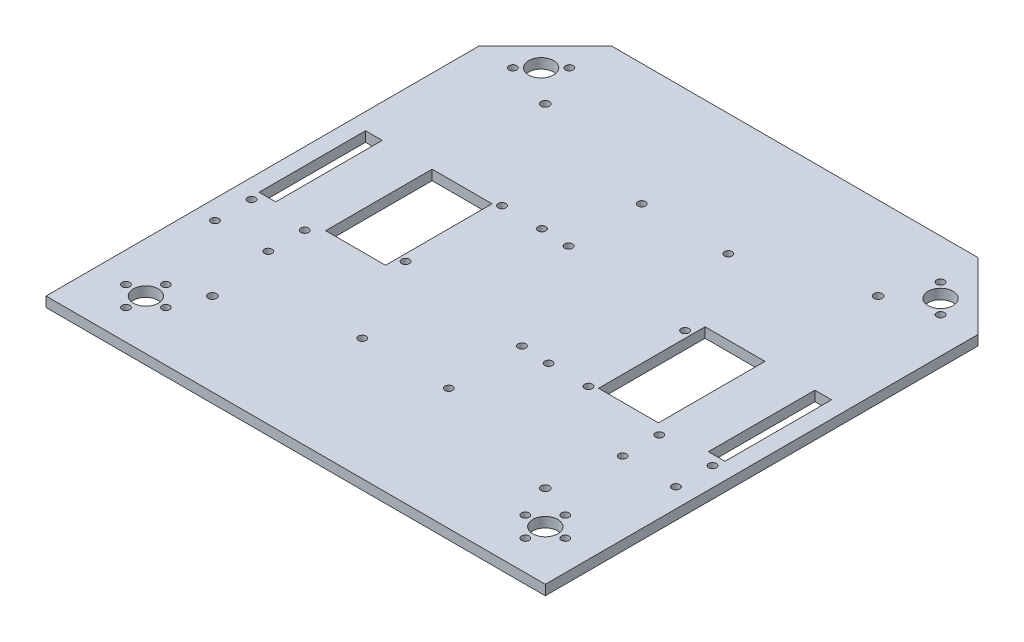
from build123d import *

# Parameters (mm, degrees)
ESQUISSE1_R              = 7.5
ESQUISSE1_R_2            = 2.3
BOSS_EXTRU_1_DEPTH       = 6
ENL_V_MAT_EXTRU_9_DEPTH  = 10.5
ESQUISSE6_R              = 2.3
ENL_V_MAT_EXTRU_10_DEPTH = 50
ENL_V_MAT_EXTRU_11_DEPTH = 50
ESQUISSE9_R              = 2.5
ENL_V_MAT_EXTRU_12_DEPTH = 35
ESQUISSE11_R             = 2.3
ENL_V_MAT_EXTRU_15_DEPTH = 10


with BuildPart() as part:
    # Esquisse1 → Boss.-Extru.1 (new body)
    with BuildSketch(Plane(origin=(0, 0, 0), x_dir=(1, 0, 0), z_dir=(0, 1, 0))):
        Polygon((-150, 0), (-150, 260), (-110, 300), (110, 300), (150, 260), (150, 0), align=None)
        with Locations(Location((-120, 30, 0), (0, 0, 270))):
            Circle(ESQUISSE1_R, mode=Mode.SUBTRACT)
        with Locations(Location((-120, 267.5, 0), (0, 0, 270))):
            Circle(ESQUISSE1_R, mode=Mode.SUBTRACT)
        with Locations(Location((120, 267.5, 0), (0, 0, 270))):
            Circle(ESQUISSE1_R, mode=Mode.SUBTRACT)
        with Locations(Location((-111.514718626, 275.985281374, 0), (0, 0, 270))):
            Circle(ESQUISSE1_R_2, mode=Mode.SUBTRACT)
        with Locations(Location((-128.485281374, 259.014718626, 0), (0, 0, 270))):
            Circle(ESQUISSE1_R_2, mode=Mode.SUBTRACT)
        with Locations(Location((111.514718626, 275.985281374, 0), (0, 0, 270))):
            Circle(ESQUISSE1_R_2, mode=Mode.SUBTRACT)
        with Locations(Location((128.485281374, 259.014718626, 0), (0, 0, 270))):
            Circle(ESQUISSE1_R_2, mode=Mode.SUBTRACT)
        with Locations(Location((120, 30, 0), (0, 0, 270))):
            Circle(ESQUISSE1_R, mode=Mode.SUBTRACT)
        with Locations(Location((120, 42, 0), (0, 0, 270))):
            Circle(ESQUISSE1_R_2, mode=Mode.SUBTRACT)
        with Locations(Location((-120, 42, 0), (0, 0, 270))):
            Circle(ESQUISSE1_R_2, mode=Mode.SUBTRACT)
        with Locations(Location((-120, 18, 0), (0, 0, 270))):
            Circle(ESQUISSE1_R_2, mode=Mode.SUBTRACT)
        with Locations(Location((-132, 30, 0), (0, 0, 270))):
            Circle(ESQUISSE1_R_2, mode=Mode.SUBTRACT)
        with Locations(Location((-108, 30, 0), (0, 0, 270))):
            Circle(ESQUISSE1_R_2, mode=Mode.SUBTRACT)
        with Locations(Location((108, 30, 0), (0, 0, 270))):
            Circle(ESQUISSE1_R_2, mode=Mode.SUBTRACT)
        with Locations(Location((132, 30, 0), (0, 0, 270))):
            Circle(ESQUISSE1_R_2, mode=Mode.SUBTRACT)
        with Locations(Location((120, 18, 0), (0, 0, 270))):
            Circle(ESQUISSE1_R_2, mode=Mode.SUBTRACT)
    extrude(amount=BOSS_EXTRU_1_DEPTH)

    # Esquisse7 → Enlèv. mat.-Extru.9 (cut)
    with BuildSketch(Plane(origin=(0, 6, 0), x_dir=(1, 0, 0), z_dir=(0, 1, 0))):
        Polygon((-130, 150), (-130, 182), (-140, 182), (-140, 118), (-130, 118), align=None)
    enl_v_mat_extru_9 = extrude(amount=-ENL_V_MAT_EXTRU_9_DEPTH, mode=Mode.SUBTRACT)

    # Esquisse6 → Enlèv. mat.-Extru.10 (cut)
    with BuildSketch(Plane(origin=(0, 6, 0), x_dir=(1, 0, 0), z_dir=(0, 1, 0))):
        with Locations(Location((-138.5, 90, 0), (0, 0, 270))):
            Circle(ESQUISSE6_R)
        with Locations(Location((-138.5, 112, 0), (0, 0, 270))):
            Circle(ESQUISSE6_R)
        with Locations(Location((-106.5, 112, 0), (0, 0, 270))):
            Circle(ESQUISSE6_R)
        with Locations(Location((-106.5, 90, 0), (0, 0, 270))):
            Circle(ESQUISSE6_R)
    enl_v_mat_extru_10 = extrude(amount=-ENL_V_MAT_EXTRU_10_DEPTH, mode=Mode.SUBTRACT)

    # Esquisse4 → Enlèv. mat.-Extru.11 (cut)
    with BuildSketch(Plane(origin=(0, 6, 0), x_dir=(1, 0, 0), z_dir=(0, 1, 0))):
        Polygon((-100, 150), (-100, 182), (-64, 182), (-64, 118), (-100, 118), align=None)
    enl_v_mat_extru_11 = extrude(amount=-ENL_V_MAT_EXTRU_11_DEPTH, mode=Mode.SUBTRACT)

    # Symétrie1: Enlèv. mat.-Extru.9 across plane
    add(enl_v_mat_extru_9.mirror(Plane(origin=(0, 0, 0), x_dir=(0, 0, 1), z_dir=(1, 0, 0))), mode=Mode.SUBTRACT)

    # Symétrie2: Enlèv. mat.-Extru.11 across plane
    add(enl_v_mat_extru_11.mirror(Plane(origin=(0, 0, 0), x_dir=(0, 0, 1), z_dir=(1, 0, 0))), mode=Mode.SUBTRACT)

    # Symétrie3: Enlèv. mat.-Extru.10 across plane
    add(enl_v_mat_extru_10.mirror(Plane(origin=(0, 0, 0), x_dir=(0, 0, 1), z_dir=(1, 0, 0))), mode=Mode.SUBTRACT)

    # Esquisse9 → Enlèv. mat.-Extru.12 (cut)
    with BuildSketch(Plane(origin=(0, 6, 0), x_dir=(1, 0, 0), z_dir=(0, 1, 0))):
        with Locations(Location((-100, 50, 0), (0, 0, 270))):
            Circle(ESQUISSE9_R)
        with Locations(Location((100, 50, 0), (0, 0, 270))):
            Circle(ESQUISSE9_R)
        with Locations(Location((100, 250, 0), (0, 0, 270))):
            Circle(ESQUISSE9_R)
        with Locations(Location((-100, 250, 0), (0, 0, 270))):
            Circle(ESQUISSE9_R)
    extrude(amount=-ENL_V_MAT_EXTRU_12_DEPTH, mode=Mode.SUBTRACT)

    # Esquisse11 → Enlèv. mat.-Extru.15 (cut)
    with BuildSketch(Plane(origin=(0, 6, 0), x_dir=(1, 0, 0), z_dir=(0, 1, 0))):
        with Locations(Location((36, 116, 0), (0, 0, 270))):
            Circle(ESQUISSE11_R)
        with Locations(Location((60, 116, 0), (0, 0, 270))):
            Circle(ESQUISSE11_R)
        with Locations(Location((60, 174, 0), (0, 0, 270))):
            Circle(ESQUISSE11_R)
        with Locations(Location((-19, 227, 0), (0, 0, 270))):
            Circle(ESQUISSE11_R)
        with Locations(Location((-19, 183, 0), (0, 0, 270))):
            Circle(ESQUISSE11_R)
        with Locations(Location((33, 227, 0), (0, 0, 270))):
            Circle(ESQUISSE11_R)
        with Locations(Location((19, 117, 0), (0, 0, 270))):
            Circle(ESQUISSE11_R)
        with Locations(Location((19, 73, 0), (0, 0, 270))):
            Circle(ESQUISSE11_R)
        with Locations(Location((-33, 73, 0), (0, 0, 270))):
            Circle(ESQUISSE11_R)
        with Locations(Location((-60, 126, 0), (0, 0, 270))):
            Circle(ESQUISSE11_R)
        with Locations(Location((-36, 184, 0), (0, 0, 270))):
            Circle(ESQUISSE11_R)
        with Locations(Location((-60, 184, 0), (0, 0, 270))):
            Circle(ESQUISSE11_R)
    extrude(amount=-ENL_V_MAT_EXTRU_15_DEPTH, mode=Mode.SUBTRACT)


solid = part.part
